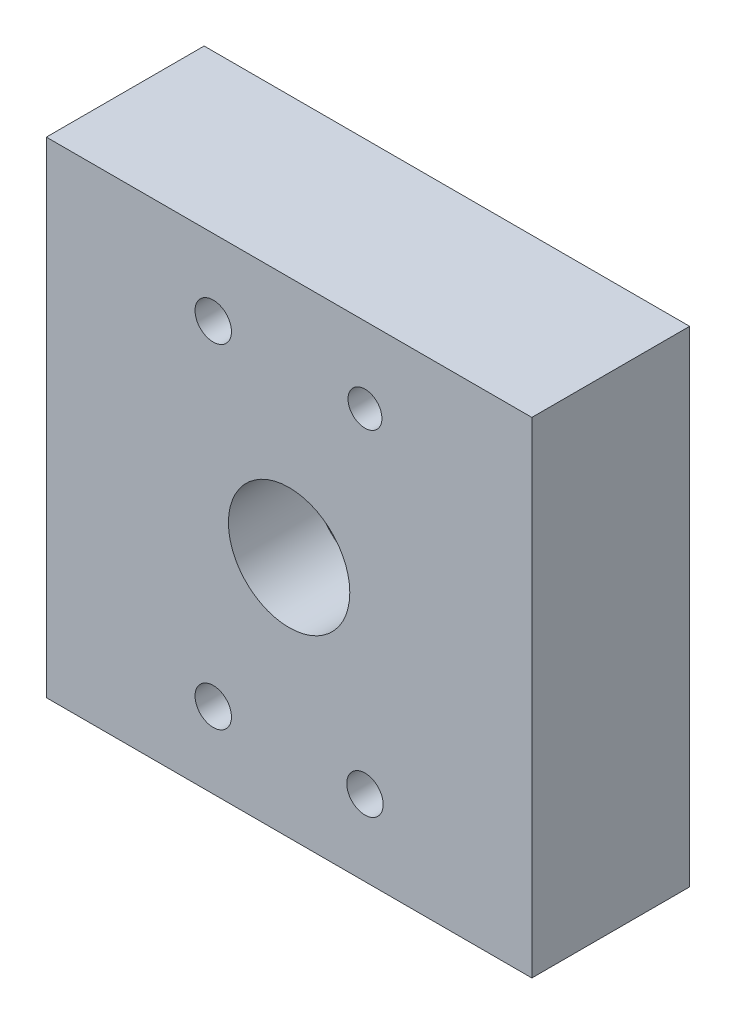
from build123d import *

# Parameters (mm, degrees)
SKETCH1_W           = 40
SKETCH1_H           = 40
SKETCH1_R           = 0.9
BOSS_EXTRUDE1_DEPTH = 6
SKETCH11_W          = 40
SKETCH11_H          = 40
SKETCH11_R          = 5
BOSS_EXTRUDE6_DEPTH = 7
SKETCH13_R          = 1.5
SKETCH13_R_2        = 1.395390764
CUT_EXTRUDE5_DEPTH  = 27
SKETCH13_3_R        = 3
SKETCH13_3_R_2      = 1.5
CUT_EXTRUDE6_DEPTH  = 3


with BuildPart() as part:
    # Sketch1 → Boss-Extrude1 (new body)
    with BuildSketch(Plane(origin=(0, 0, 0), x_dir=(0, 1, 0), z_dir=(0, 0, 1))):
        Rectangle(SKETCH1_W, SKETCH1_H)
        Polygon((-5, -5), (-5, 5), (5, 5), (5, -5), (5, -13), (-5, -13), (-8, -13), (-8, -5), align=None, mode=Mode.SUBTRACT)
        with Locations((10.5, 0)):
            Circle(SKETCH1_R, mode=Mode.SUBTRACT)
        with Locations((-10.5, 0)):
            Circle(SKETCH1_R, mode=Mode.SUBTRACT)
        with Locations((-10.5, 12.5)):
            Circle(SKETCH1_R, mode=Mode.SUBTRACT)
        with Locations((10.5, 12.5)):
            Circle(SKETCH1_R, mode=Mode.SUBTRACT)
    extrude(amount=BOSS_EXTRUDE1_DEPTH)

    # Sketch11 → Boss-Extrude6 (add)
    with BuildSketch(Plane.XY.offset(6)):
        Rectangle(SKETCH11_W, SKETCH11_H)
        Circle(SKETCH11_R, mode=Mode.SUBTRACT)
    extrude(amount=BOSS_EXTRUDE6_DEPTH)

    # Sketch13 → Cut-Extrude5 (cut)
    with BuildSketch(Plane(origin=(0, 0, 0), x_dir=(1, 0, 0), z_dir=(0, 0, -1))):
        with Locations((-6.25, 13.75)):
            Circle(SKETCH13_R)
        with Locations((6.25, 13.75)):
            Circle(SKETCH13_R)
        with Locations((-6.25, -13.75)):
            Circle(SKETCH13_R)
        with Locations((6.25, -13.75)):
            Circle(SKETCH13_R_2)
    extrude(amount=-CUT_EXTRUDE5_DEPTH, mode=Mode.SUBTRACT)

    # Sketch13<3> → Cut-Extrude6 (cut)
    # profile 1 of 4: a face of its own
    with BuildSketch(Plane(origin=(0, 0, 0), x_dir=(1, 0, 0), z_dir=(0, 0, -1))):
        with Locations((6.25, -13.75)):
            Circle(SKETCH13_3_R)
    # profile 2 of 4: a face of its own
    with BuildSketch(Plane(origin=(0, 0, 0), x_dir=(1, 0, 0), z_dir=(0, 0, -1))):
        with Locations((-6.25, 13.75)):
            Circle(SKETCH13_3_R)
        with Locations((-6.25, 13.75)):
            Circle(SKETCH13_3_R_2, mode=Mode.SUBTRACT)
    # profile 3 of 4: a face of its own
    with BuildSketch(Plane(origin=(0, 0, 0), x_dir=(1, 0, 0), z_dir=(0, 0, -1))):
        with Locations((6.25, 13.75)):
            Circle(SKETCH13_3_R)
        with Locations((6.25, 13.75)):
            Circle(SKETCH13_3_R_2, mode=Mode.SUBTRACT)
    # profile 4 of 4: a face of its own
    with BuildSketch(Plane(origin=(0, 0, 0), x_dir=(1, 0, 0), z_dir=(0, 0, -1))):
        with Locations((-6.25, -13.75)):
            Circle(SKETCH13_3_R)
        with Locations((-6.25, -13.75)):
            Circle(SKETCH13_3_R_2, mode=Mode.SUBTRACT)
    extrude(amount=-CUT_EXTRUDE6_DEPTH, mode=Mode.SUBTRACT)


solid = part.part
